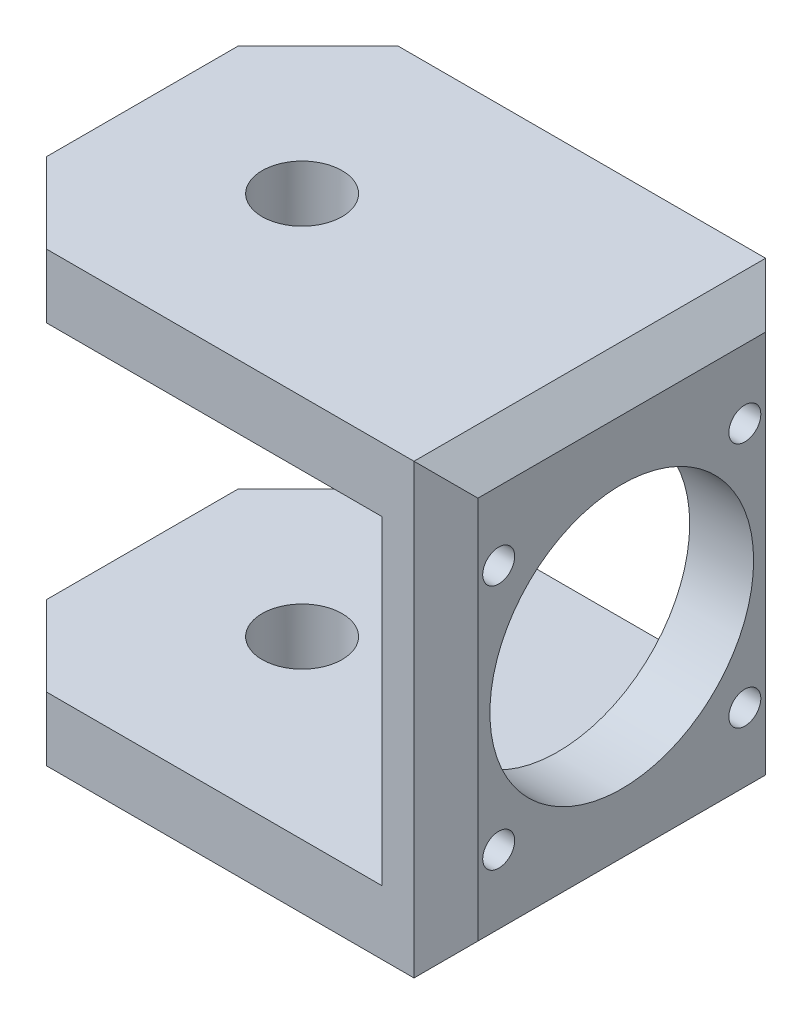
from build123d import *

# Parameters (mm, degrees)
SKETCH1_W           = 30
SKETCH1_H           = 22
BOSS_EXTRUDE1_DEPTH = 4
SKETCH2_W           = 4
SKETCH2_H           = 22
BOSS_EXTRUDE2_DEPTH = 20
SKETCH3_W           = 30
SKETCH3_H           = 22
BOSS_EXTRUDE3_DEPTH = 4
CHAMFER1_SIZE       = 5
SKETCH4_R           = 8.25
CUT_EXTRUDE1_DEPTH  = 43.485291572
SKETCH5_R           = 1
CUT_EXTRUDE2_DEPTH  = 43.485291572
CHAMFER2_SIZE       = 2
SKETCH6_R           = 2.5
CUT_EXTRUDE3_DEPTH  = 34.615472628


with BuildPart() as part:
    # Sketch1 → Boss-Extrude1 (new body)
    with BuildSketch(Plane(origin=(0, 0, 0), x_dir=(1, 0, 0), z_dir=(0, 1, 0))):
        Rectangle(SKETCH1_W, SKETCH1_H)
    extrude(amount=BOSS_EXTRUDE1_DEPTH)

    # Sketch2 → Boss-Extrude2 (add)
    with BuildSketch(Plane(origin=(0, 4, 0), x_dir=(1, 0, 0), z_dir=(0, 1, 0))):
        with Locations((13, 0)):
            Rectangle(SKETCH2_W, SKETCH2_H)
    extrude(amount=BOSS_EXTRUDE2_DEPTH)

    # Sketch3 → Boss-Extrude3 (add)
    with BuildSketch(Plane(origin=(0, 24, 0), x_dir=(1, 0, 0), z_dir=(0, 1, 0))):
        Rectangle(SKETCH3_W, SKETCH3_H)
    extrude(amount=BOSS_EXTRUDE3_DEPTH)

    # Chamfer1
    chamfer1_edges = [part.edges().sort_by_distance(p)[0] for p in [
        (-15, 2, 11),
        (-15, 2, -11),
        (-15, 26, -11),
        (-15, 26, 11),
    ]]
    chamfer(chamfer1_edges, length=CHAMFER1_SIZE)

    # Sketch4 → Cut-Extrude1 (cut, through all)
    with BuildSketch(Plane(origin=(15, 0, 0), x_dir=(0, 0, -1), z_dir=(1, 0, 0))):
        with Locations((0, 14)):
            Circle(SKETCH4_R)
    extrude(amount=-CUT_EXTRUDE1_DEPTH, mode=Mode.SUBTRACT)

    # Sketch5 → Cut-Extrude2 (cut, through all)
    with BuildSketch(Plane(origin=(15, 0, 0), x_dir=(0, 0, -1), z_dir=(1, 0, 0))):
        with Locations((-7.7, 6.3)):
            Circle(SKETCH5_R)
        with Locations((-7.7, 21.7)):
            Circle(SKETCH5_R)
        with Locations((7.7, 21.7)):
            Circle(SKETCH5_R)
        with Locations((7.7, 6.3)):
            Circle(SKETCH5_R)
    extrude(amount=-CUT_EXTRUDE2_DEPTH, mode=Mode.SUBTRACT)

    # Chamfer2
    chamfer2_edges = [part.edges().sort_by_distance(p)[0] for p in [
        (15, 14, -11),
        (15, 0, 0),
        (15, 14, 11),
        (15, 28, 0),
    ]]
    chamfer(chamfer2_edges, length=CHAMFER2_SIZE)

    # Sketch6 → Cut-Extrude3 (cut, through all)
    with BuildSketch(Plane(origin=(0, 28, 0), x_dir=(1, 0, 0), z_dir=(0, 1, 0))):
        with Locations((-5, 0)):
            Circle(SKETCH6_R)
    extrude(amount=-CUT_EXTRUDE3_DEPTH, mode=Mode.SUBTRACT)


solid = part.part
